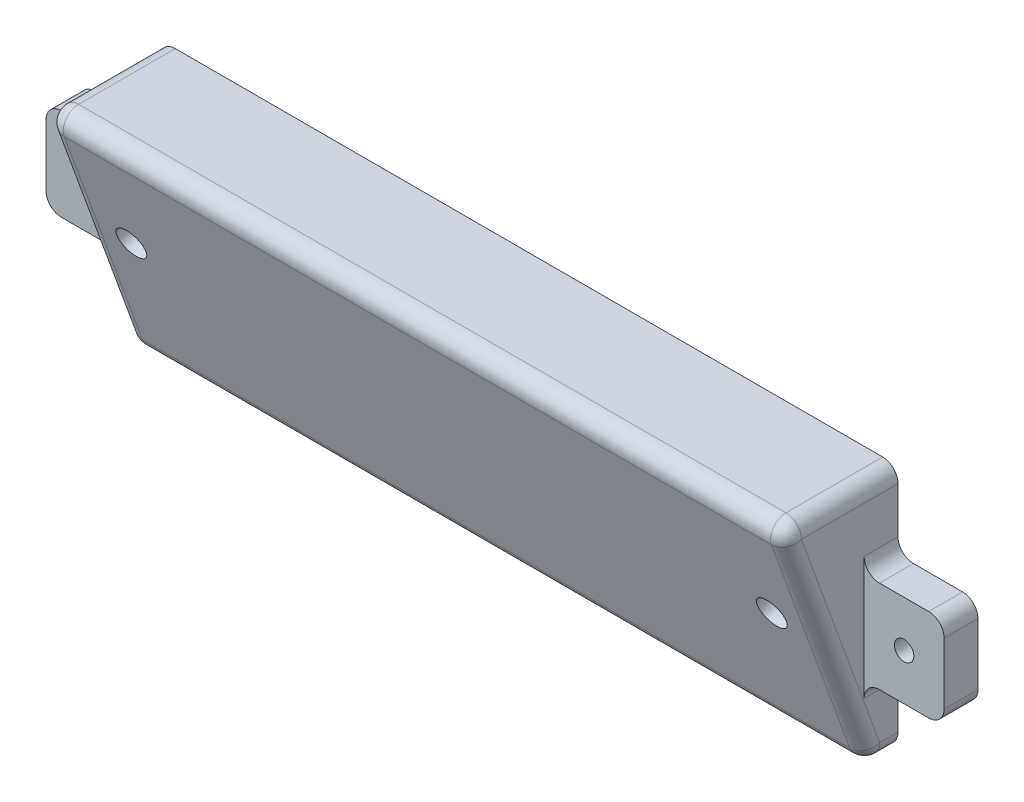
from build123d import *

# Parameters (mm, degrees)
SKETCH1_W           = 152.4
SKETCH1_H           = 50.8
BOSS_EXTRUDE1_DEPTH = 6
BOSS_EXTRUDE2_DEPTH = 152.4
SKETCH7_W           = 16.51
SKETCH7_H           = 19.05
SKETCH7_R           = 2
BOSS_EXTRUDE3_DEPTH = 7
FILLET1_R           = 3.175
SKETCH8_R           = 3.025
CUT_EXTRUDE1_DEPTH  = 10


with BuildPart() as part:
    # Sketch1 → Boss-Extrude1 (new body)
    with BuildSketch(Plane.XY):
        Rectangle(SKETCH1_W, SKETCH1_H)
    extrude(amount=BOSS_EXTRUDE1_DEPTH)

    # Sketch5 → Boss-Extrude2 (add)
    with BuildSketch(Plane.ZY.offset(76.2)):
        Polygon((6, 25.4), (24.489687901, 25.4), (6, -25.4), align=None)
    extrude(amount=-BOSS_EXTRUDE2_DEPTH)

    # Sketch7 → Boss-Extrude3 (add)
    # profile 1 of 2: a face of its own
    with BuildSketch(Plane(origin=(0, 0, 0), x_dir=(-1, 0, 0), z_dir=(0, 0, -1))):
        with Locations((-84.455, 0)):
            Rectangle(SKETCH7_W, SKETCH7_H)
        with Locations((-84.455, 0)):
            Circle(SKETCH7_R, mode=Mode.SUBTRACT)
    # profile 2 of 2: a face of its own
    with BuildSketch(Plane(origin=(0, 0, 0), x_dir=(-1, 0, 0), z_dir=(0, 0, -1))):
        with Locations((84.455, 0)):
            Rectangle(SKETCH7_W, SKETCH7_H)
        with Locations((84.455, 0)):
            Circle(SKETCH7_R, mode=Mode.SUBTRACT)
    extrude(amount=-BOSS_EXTRUDE3_DEPTH)

    # Fillet1
    fillet1_edges = [part.edges().sort_by_distance(p)[0] for p in [
        (-76.2, 0, 15.24484395),
        (76.2, 0, 15.24484395),
        (0, 25.4, 24.489687901),
        (0, -25.4, 6),
        (76.2, -9.525, 3.5),
        (92.71, -9.525, 3.5),
        (92.71, 9.525, 3.5),
        (76.2, 9.525, 3.5),
        (-76.2, -9.525, 3.5),
        (-76.2, 9.525, 3.5),
        (-92.71, 9.525, 3.5),
        (-92.71, -9.525, 3.5),
        (76.2, -25.4, 3),
        (-76.2, -25.4, 3),
        (-76.2, 25.4, 12.24484395),
        (76.2, 25.4, 12.24484395),
    ]]
    fillet(fillet1_edges, radius=FILLET1_R)

    # Sketch8 → Cut-Extrude1 (cut)
    with BuildSketch(Plane(origin=(0, -4.899598401, 13.461535972), x_dir=(1, 0, 0), z_dir=(0, -0.3420201433256695, 0.9396926207859082))):
        with Locations(Location((-66.11875, 7.355813283, 0), (0, 0, 270))):
            Circle(SKETCH8_R)
        with Locations(Location((66.11875, 7.355813283, 0), (0, 0, 270))):
            Circle(SKETCH8_R)
    extrude(amount=-CUT_EXTRUDE1_DEPTH, mode=Mode.SUBTRACT)


solid = part.part
